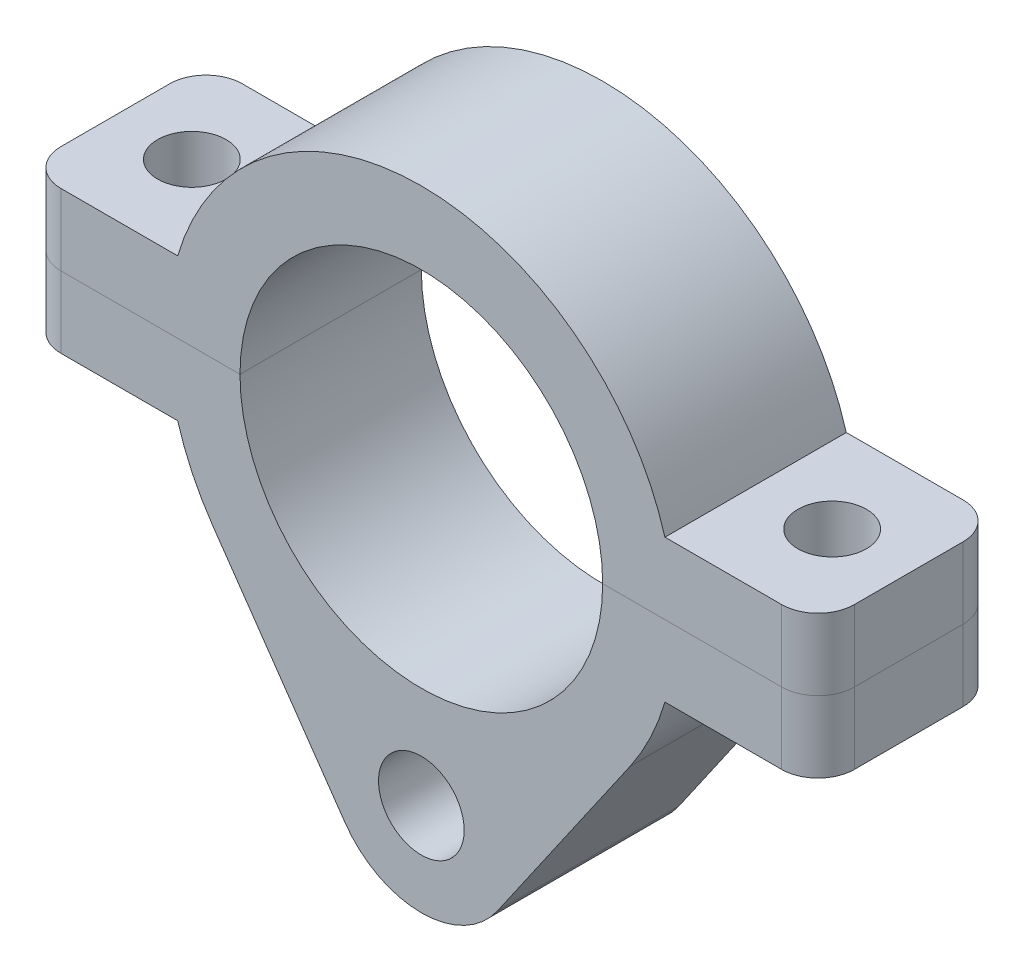
from build123d import *

# Parameters (mm, degrees)
SKETCH1_R            = 12.7
SKETCH1_R_2          = 3
BOSS_EXTRUDE1_DEPTH  = 12.7
M4_CLEARANCE_HOLE1_D = 4.8
FILLET1_R            = 2.54


with BuildPart() as part:
    # Sketch1 → Boss-Extrude1 (new body)
    with BuildSketch(Plane.XY):
        with BuildLine():
            ThreePointArc((-5.343610447, -23.512787402), (0, -26.312), (5.343610447, -23.512787402))
            Line((5.343610447, -23.512787402), (14.616829807, -10.123076923))
            ThreePointArc((14.616829807, -10.123076923), (16.04544261, -7.6597762), (17.062485165, -5))
            Line((17.062485165, -5), (27.78, -5))
            Line((27.78, -5), (27.78, 5))
            Line((27.78, 5), (17.062485165, 5))
            ThreePointArc((17.062485165, 5), (0, 17.78), (-17.062485165, 5))
            Line((-17.062485165, 5), (-27.78, 5))
            Line((-27.78, 5), (-27.78, -5))
            Line((-27.78, -5), (-17.062485165, -5))
            ThreePointArc((-17.062485165, -5), (-16.04544261, -7.6597762), (-14.616829807, -10.123076923))
            Line((-14.616829807, -10.123076923), (-5.343610447, -23.512787402))
        make_face()
        Circle(SKETCH1_R, mode=Mode.SUBTRACT)
        with Locations((0, -19.812)):
            Circle(SKETCH1_R_2, mode=Mode.SUBTRACT)
    extrude(amount=BOSS_EXTRUDE1_DEPTH)

    # M4 Clearance Hole1 (through all)
    with Locations(Plane(origin=(0, -5, 0), x_dir=(-1, 0, 0), z_dir=(0, -1, 0))):
        with Locations((-22.421242582, -6.35), (22.421242582, -6.35)):
            Hole(M4_CLEARANCE_HOLE1_D / 2)

    # Fillet1
    fillet1_edges = [part.edges().sort_by_distance(p)[0] for p in [
        (-27.78, 0, 0),
        (27.78, 0, 12.7),
        (27.78, 0, 0),
        (-27.78, 0, 12.7),
    ]]
    fillet(fillet1_edges, radius=FILLET1_R)


with BuildPart() as body_2:
    # Split1: the piece on the far side of the plane
    add(part.part)
    split(bisect_by=Plane(origin=(0, 0, 0), x_dir=(0, 0, -1), z_dir=(0, -1, 0)), keep=Keep.BOTTOM)


with BuildPart() as part_1:
    add(part.part)

    # Split1
    split(bisect_by=Plane(origin=(0, 0, 0), x_dir=(0, 0, -1), z_dir=(0, -1, 0)), keep=Keep.TOP)


solid = Compound([body_2.part, part_1.part])
